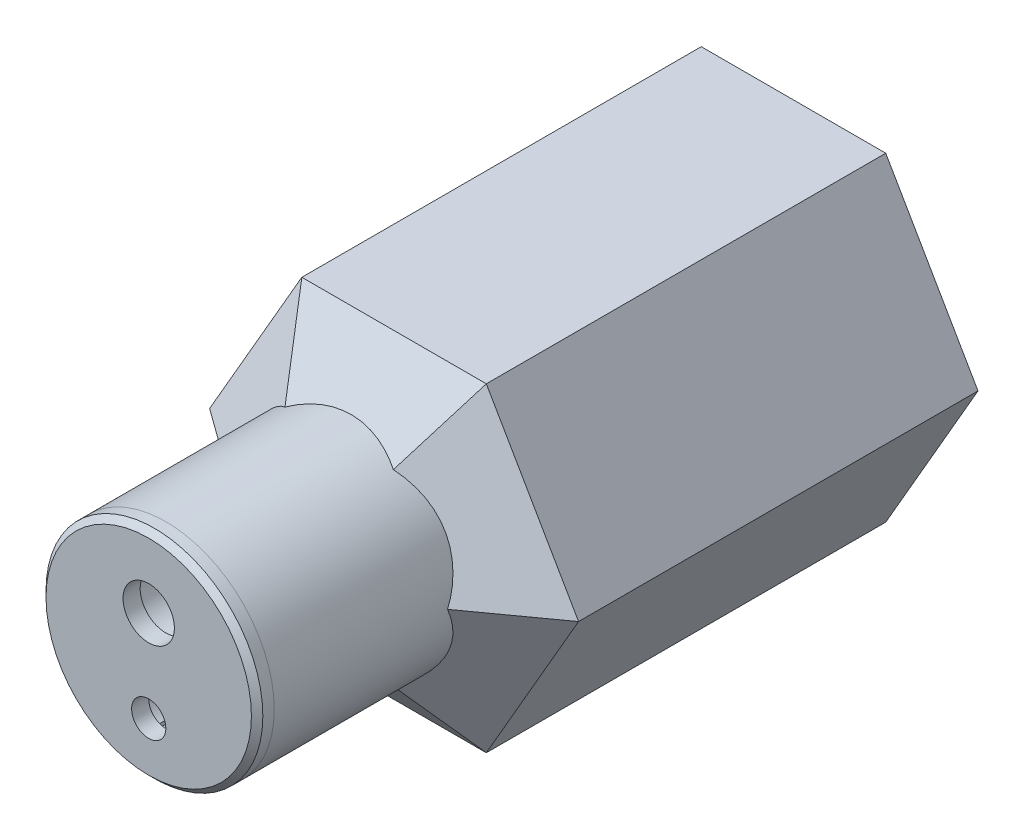
from build123d import *

# Parameters (mm, degrees)
P_IDAT_VYSUNUT_M1_DEPTH       = 35
P_IDAT_VYSUNUT_M2_DEPTH       = 2
SKICA9_R                      = 9.5
SKICA9_R_2                    = 7.5
P_IDAT_VYSUNUT_M3_DEPTH       = 15
KRUHOV_POLE1_COUNT            = 6
SKICA10_R                     = 9.5
SKICA10_R_2                   = 7.5
P_IDAT_VYSUNUT_M4_DEPTH       = 1.5
ODEBRAT_VYSUNUT_M1_DEPTH      = 10
ODEBRAT_VYSUNUT_M1_DEPTH_BACK = 45.040700872
SKICA11_R                     = 7.5
P_IDAT_VYSUNUT_M5_DEPTH       = 6.7
ZKOSEN_2_SIZE                 = 3
P_IDAT_VYSUNUT_M6_REACH       = 43.016
P_IDAT_VYSUNUT_M7_DEPTH       = 1
P_IDAT_VYSUNUT_M8_DEPTH       = 1.8
SKICA18_R                     = 9.5
P_IDAT_VYSUNUT_M9_DEPTH       = 1.5
SKICA19_R                     = 2.25
SKICA19_R_2                   = 1.5
ODEBRAT_VYSUNUT_M3_DEPTH      = 1.5
P_IDAT_VYSUNUT_M11_DEPTH      = 4
P_IDAT_VYSUNUT_M11_2_DEPTH    = 4
SKICA20_R                     = 2.75
P_IDAT_VYSUNUT_M11_3_DEPTH    = 4
ZKOSEN_3_SIZE                 = 0.5


with BuildPart() as part:
    # Skica1 → Přidat vysunutím1 (new body)
    with BuildSketch(Plane.XY):
        Polygon((-16.165807537, 0), (-8.082903769, -14), (8.082903769, -14), (16.165807537, 0), (8.082903769, 14), (-8.082903769, 14), align=None)
        Polygon((12.701705922, 2), (6.92820323, 12), (-6.92820323, 12), (-12.701705922, 2), (-9.356406461, 2), (-9.356406461, 0), (-10.206406461, 0), (-10.206406461, -1.8), (-8.706406461, -1.8), (-8.706406461, -3.8), (-11.662475438, -3.8), (-6.92820323, -12), (6.92820323, -12), (11.662475438, -3.8), (8.706406461, -3.8), (8.706406461, -1.8), (10.206406461, -1.8), (10.206406461, 0), (9.356406461, 0), (9.356406461, 2), align=None, mode=Mode.SUBTRACT)
    extrude(amount=P_IDAT_VYSUNUT_M1_DEPTH)


with BuildPart() as body_2:
    # Skica6 → Přidat vysunutím2 (new body)
    with BuildSketch(Plane(origin=(0, 22.950819672, 27.540983607), x_dir=(-1, 0, 0), z_dir=(2.1639563313744068e-15, -0.6401843996644798, -0.768221279597376))):
        Polygon((-4.618802154, -19.46160575), (4.618802154, -19.46160575), (8.082903769, -11.651356074), (-8.082903769, -11.651356074), align=None)
    extrude(amount=P_IDAT_VYSUNUT_M2_DEPTH)


with BuildPart() as body_3:
    # Skica9 → Přidat vysunutím3 (new body)
    with BuildSketch(Plane.XY.offset(40)):
        Circle(SKICA9_R)
        Circle(SKICA9_R_2, mode=Mode.SUBTRACT)
    extrude(amount=P_IDAT_VYSUNUT_M3_DEPTH)


with BuildPart() as kruhov_pole1_1:
    # Kruhové pole1: pattern copy
    add(body_2.part.rotate(Axis((0, 0, 0), (0, 0, 1)), 1 * 360 / KRUHOV_POLE1_COUNT))


with BuildPart() as kruhov_pole1_2:
    # Kruhové pole1: pattern copy
    add(body_2.part.rotate(Axis((0, 0, 0), (0, 0, 1)), 2 * 360 / KRUHOV_POLE1_COUNT))


with BuildPart() as kruhov_pole1_3:
    # Kruhové pole1: pattern copy
    add(body_2.part.rotate(Axis((0, 0, 0), (0, 0, 1)), 3 * 360 / KRUHOV_POLE1_COUNT))


with BuildPart() as kruhov_pole1_4:
    # Kruhové pole1: pattern copy
    add(body_2.part.rotate(Axis((0, 0, 0), (0, 0, 1)), 4 * 360 / KRUHOV_POLE1_COUNT))


with BuildPart() as kruhov_pole1_5:
    # Kruhové pole1: pattern copy
    add(body_2.part.rotate(Axis((0, 0, 0), (0, 0, 1)), 5 * 360 / KRUHOV_POLE1_COUNT))


with BuildPart() as body_2_1:
    add(body_2.part)

    add(body_3.part)  # Přidat vysunutím4 merges body 3

    add(kruhov_pole1_1.part)  # Přidat vysunutím4 merges Kruhové pole1_1

    add(kruhov_pole1_2.part)  # Přidat vysunutím4 merges Kruhové pole1_2

    add(kruhov_pole1_3.part)  # Přidat vysunutím4 merges Kruhové pole1_3

    add(kruhov_pole1_4.part)  # Přidat vysunutím4 merges Kruhové pole1_4

    add(kruhov_pole1_5.part)  # Přidat vysunutím4 merges Kruhové pole1_5
    # Skica10 → Přidat vysunutím4 (add)
    with BuildSketch(Plane(origin=(0, 0, 40), x_dir=(-1, 0, 0), z_dir=(0, 0, -1))):
        with Locations(Location((0, 0, 0), (0, 0, 180))):
            Circle(SKICA10_R)
        with Locations(Location((0, 0, 0), (0, 0, 180))):
            Circle(SKICA10_R_2, mode=Mode.SUBTRACT)
    extrude(amount=P_IDAT_VYSUNUT_M4_DEPTH)

    # Skica11 → Odebrat vysunutím1 (cut, two sides: drawn at the far end of the back side and taken through both)
    with BuildSketch(Plane(origin=(0, 0, 38.5), x_dir=(-1, 0, 0), z_dir=(0, 0, -1)).offset(-ODEBRAT_VYSUNUT_M1_DEPTH_BACK)):
        with Locations(Location((0, 0, 0), (0, 0, 180))):
            Circle(SKICA11_R)
    extrude(amount=ODEBRAT_VYSUNUT_M1_DEPTH + ODEBRAT_VYSUNUT_M1_DEPTH_BACK, mode=Mode.SUBTRACT)

    # Skica12 → Přidat vysunutím5 (add)
    with BuildSketch(Plane(origin=(0, 0, 38.5), x_dir=(-1, 0, 0), z_dir=(0, 0, -1))):
        Polygon((-4, -1.8), (-5.2, -1.8), (-5.2, 0), (-4, 0), (-4, 1), (-7.5, 1), (-7.5, -2.8), (-4, -2.8), align=None)
        Polygon((7.5, -2.8), (7.5, 1), (4, 1), (4, 0), (5.2, 0), (5.2, -1.8), (4, -1.8), (4, -2.8), align=None)
    extrude(amount=-P_IDAT_VYSUNUT_M5_DEPTH)

    # Zkosení2
    zkosen_2_edges = [body_2_1.edges().sort_by_distance(p)[0] for p in [
        (-4, -2.3, 38.5),
        (4, 0.5, 38.5),
    ]]
    chamfer(zkosen_2_edges, length=ZKOSEN_2_SIZE)

    # Skica14 → Přidat vysunutím6 (add, up to next)
    with BuildSketch(Plane.XY.offset(35), mode=Mode.PRIVATE) as p_idat_vysunut_m6_sk1:
        Polygon((-9.356406461, 2), (-12.701705922, 2), (-11.662475438, -3.8), (-8.706406461, -3.8), (-8.706406461, -1.8), (-10.206406461, -1.8), (-10.206406461, 0), (-9.356406461, 0), align=None)
    p_idat_vysunut_m6_tool1 = extrude(p_idat_vysunut_m6_sk1.sketch, amount=P_IDAT_VYSUNUT_M6_REACH, mode=Mode.PRIVATE) - body_2_1.part
    # Skica14 → Přidat vysunutím6 (add, up to next)
    with BuildSketch(Plane.XY.offset(35), mode=Mode.PRIVATE) as p_idat_vysunut_m6_sk2:
        Polygon((11.662475438, -3.8), (8.706406461, -3.8), (8.706406461, -1.8), (10.206406461, -1.8), (10.206406461, 0), (9.356406461, 0), (9.356406461, 2), (12.701705922, 2), align=None)
    p_idat_vysunut_m6_tool2 = extrude(p_idat_vysunut_m6_sk2.sketch, amount=P_IDAT_VYSUNUT_M6_REACH, mode=Mode.PRIVATE) - body_2_1.part

    add(part.part)  # Přidat vysunutím6 merges part
    add(p_idat_vysunut_m6_tool1.solids().sort_by_distance((-10.739123, -0.872566, 35))[0])
    add(p_idat_vysunut_m6_tool2.solids().sort_by_distance((10.739123, -0.872566, 35))[0])

    # Skica16 → Přidat vysunutím7 (add)
    with BuildSketch(Plane.XY.offset(45.2)):
        with BuildLine():
            Line((-4, -2.8), (-4, 1))
            Line((-4, 1), (-7.433034374, 1))
            ThreePointArc((-7.433034374, 1), (-7.44201057, -0.930848364), (-6.957729515, -2.8))
            Line((-6.957729515, -2.8), (-4, -2.8))
        make_face()
        with BuildLine():
            Line((4, -2.8), (4, 1))
            Line((4, 1), (7.433034374, 1))
            ThreePointArc((7.433034374, 1), (7.44201057, -0.930848364), (6.957729515, -2.8))
            Line((6.957729515, -2.8), (4, -2.8))
        make_face()
    extrude(amount=P_IDAT_VYSUNUT_M7_DEPTH)

    # Skica17 → Přidat vysunutím8 (add)
    with BuildSketch(Plane(origin=(0, 0, 0), x_dir=(1, 0, 0), z_dir=(0, 1, 0))):
        Polygon((-4, -45.7), (4, -45.7), (4, -46.2), (7.5, -46.2), (7.5, -55), (-7.5, -55), (-7.5, -46.2), (-4, -46.2), align=None)
    extrude(amount=-P_IDAT_VYSUNUT_M8_DEPTH)


with BuildPart() as body_2_2:
    # Skica18 → Přidat vysunutím9 (new body)
    with BuildSketch(Plane.XY.offset(55)):
        Circle(SKICA18_R)
    extrude(amount=P_IDAT_VYSUNUT_M9_DEPTH)

    # Skica19 → Odebrat vysunutím3 (cut)
    with BuildSketch(Plane.XY.offset(56.5)):
        with Locations((0, 3.3)):
            Circle(SKICA19_R)
        with Locations((0, -4.7)):
            Circle(SKICA19_R_2)
    extrude(amount=-ODEBRAT_VYSUNUT_M3_DEPTH, mode=Mode.SUBTRACT)

    # Zkosení3
    zkosen_3_edges = [body_2_2.edges().sort_by_distance(p)[0] for p in [
        (-9.5, 0, 56.5),
    ]]
    chamfer(zkosen_3_edges, length=ZKOSEN_3_SIZE)


with BuildPart() as body_3_2:
    # Skica20 → Přidat vysunutím11 (new body)
    with BuildSketch(Plane(origin=(0, 0, 55), x_dir=(-1, 0, 0), z_dir=(0, 0, -1))):
        with BuildLine():
            Line((-7.255342859, -1.9), (-6.216108107, -1.9))
            ThreePointArc((-6.216108107, -1.9), (-5.027902464, -4.119489872), (-3.085455765, -5.721010638))
            ThreePointArc((-3.085455765, -5.721010638), (-3.042394764, -3.557050263), (-1.65, -1.9))
            Line((-1.65, -1.9), (-1.467140075, -1.9))
            Line((-1.467140075, -1.9), (-1.467140075, -2.37405933))
            ThreePointArc((-1.467140075, -2.37405933), (-2.75, -4.7), (-1.467140075, -7.02594067))
            Line((-1.467140075, -7.02594067), (-1.467140075, -7.355100271))
            ThreePointArc((-1.467140075, -7.355100271), (-5.143924268, -5.45802557), (-7.255342859, -1.9))
        make_face()
    extrude(amount=P_IDAT_VYSUNUT_M11_DEPTH)


with BuildPart() as body_4:
    # Skica20 → P_idat vysunut_m11 2 (new body)
    with BuildSketch(Plane(origin=(0, 0, 55), x_dir=(-1, 0, 0), z_dir=(0, 0, -1))):
        with BuildLine():
            Line((6.216108107, -1.9), (7.255342859, -1.9))
            ThreePointArc((7.255342859, -1.9), (5.143924268, -5.45802557), (1.467140075, -7.355100271))
            Line((1.467140075, -7.355100271), (1.467140075, -7.02594067))
            ThreePointArc((1.467140075, -7.02594067), (2.75, -4.7), (1.467140075, -2.37405933))
            Line((1.467140075, -2.37405933), (1.467140075, -1.9))
            Line((1.467140075, -1.9), (1.65, -1.9))
            ThreePointArc((1.65, -1.9), (3.042394764, -3.557050263), (3.085455765, -5.721010638))
            ThreePointArc((3.085455765, -5.721010638), (5.027902464, -4.119489872), (6.216108107, -1.9))
        make_face()
    extrude(amount=P_IDAT_VYSUNUT_M11_2_DEPTH)


with BuildPart() as body_5:
    # Skica20 → P_idat vysunut_m11 3 (new body)
    with BuildSketch(Plane(origin=(0, 0, 55), x_dir=(-1, 0, 0), z_dir=(0, 0, -1))):
        with BuildLine():
            Line((-7.499333304, 0.1), (-6.499230724, 0.1))
            ThreePointArc((-6.499230724, 0.1), (-4.836067799, 4.343092014), (-0.795512173, 6.451136364))
            ThreePointArc((-0.795512173, 6.451136364), (-3.247914749, 3.183596468), (-0.567890835, 0.1))
            Line((-0.567890835, 0.1), (0.567890835, 0.1))
            ThreePointArc((0.567890835, 0.1), (3.247914749, 3.183596468), (0.795512173, 6.451136364))
            ThreePointArc((0.795512173, 6.451136364), (4.836067799, 4.343092014), (6.499230724, 0.1))
            Line((6.499230724, 0.1), (7.499333304, 0.1))
            ThreePointArc((7.499333304, 0.1), (0, 7.5), (-7.499333304, 0.1))
        make_face()
        with Locations((0, 3.3)):
            Circle(SKICA20_R, mode=Mode.SUBTRACT)
    extrude(amount=P_IDAT_VYSUNUT_M11_3_DEPTH)


solid = Compound([body_2_1.part, body_2_2.part, body_3_2.part, body_4.part, body_5.part])
